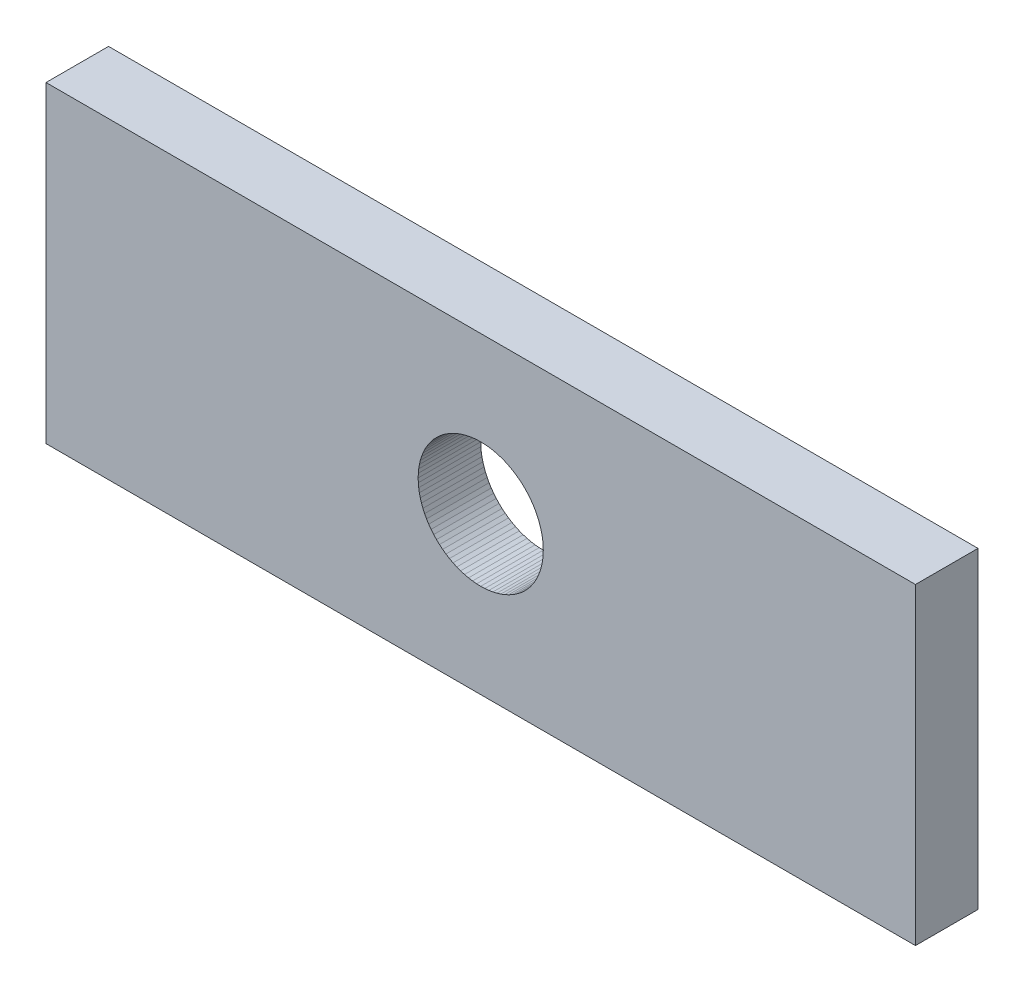
from build123d import *

# Parameters (mm, degrees)
SKETCH1_W           = 69.5
SKETCH1_H           = 25
BOSS_EXTRUDE1_DEPTH = 2.5


with BuildPart() as part:
    # Sketch1 → Boss-Extrude1 (new, symmetric)
    with BuildSketch(Plane.XY):
        with Locations((1368.295659386, -201.441167375)):
            Rectangle(SKETCH1_W, SKETCH1_H)
        Polygon((1370.795659386, -197.111040356), (1370.507102837, -196.956803667), (1370.209076548, -196.821769712), (1369.902856712, -196.706516727), (1369.589754611, -196.611538243), (1369.271110996, -196.537240973), (1368.948290347, -196.483943068), (1368.622675032, -196.451872759), (1368.295659386, -196.441167375), (1367.96864374, -196.451872759), (1367.643028425, -196.483943068), (1367.320207776, -196.537240973), (1367.00156416, -196.611538243), (1366.688462059, -196.706516727), (1366.382242224, -196.821769712), (1366.084215935, -196.956803667), (1365.795659386, -197.111040356), (1365.517808221, -197.283819313), (1365.251852241, -197.474400673), (1364.99893031, -197.681968337), (1364.76012548, -197.905633469), (1364.536460348, -198.144438299), (1364.328892684, -198.39736023), (1364.138311324, -198.66331621), (1363.965532367, -198.941167375), (1363.811295678, -199.229723924), (1363.676261723, -199.527750213), (1363.561008738, -199.833970048), (1363.466030254, -200.147072149), (1363.391732984, -200.465715765), (1363.338435079, -200.788536414), (1363.30636477, -201.114151729), (1363.295659386, -201.441167375), (1363.30636477, -201.768183021), (1363.338435079, -202.093798336), (1363.391732984, -202.416618985), (1363.466030254, -202.7352626), (1363.561008738, -203.048364701), (1363.676261723, -203.354584537), (1363.811295678, -203.652610826), (1363.965532367, -203.941167375), (1364.138311324, -204.21901854), (1364.328892684, -204.48497452), (1364.536460348, -204.73789645), (1364.76012548, -204.976701281), (1364.99893031, -205.200366412), (1365.251852241, -205.407934076), (1365.517808221, -205.598515436), (1365.795659386, -205.771294394), (1366.084215935, -205.925531082), (1366.382242224, -206.060565037), (1366.688462059, -206.175818022), (1367.00156416, -206.270796506), (1367.320207776, -206.345093777), (1367.643028425, -206.398391682), (1367.96864374, -206.430461991), (1368.295659386, -206.441167375), (1368.622675032, -206.430461991), (1368.948290347, -206.398391682), (1369.271110996, -206.345093777), (1369.589754611, -206.270796506), (1369.902856712, -206.175818022), (1370.209076548, -206.060565037), (1370.507102837, -205.925531082), (1370.795659386, -205.771294394), (1371.073510551, -205.598515436), (1371.339466531, -205.407934076), (1371.592388461, -205.200366412), (1371.831193292, -204.976701281), (1372.054858423, -204.73789645), (1372.262426087, -204.48497452), (1372.453007447, -204.21901854), (1372.625786405, -203.941167375), (1372.780023094, -203.652610826), (1372.915057048, -203.354584537), (1373.030310033, -203.048364701), (1373.125288517, -202.7352626), (1373.199585788, -202.416618985), (1373.252883693, -202.093798336), (1373.284954002, -201.768183021), (1373.295659386, -201.441167375), (1373.284954002, -201.114151729), (1373.252883693, -200.788536414), (1373.199585788, -200.465715765), (1373.125288517, -200.147072149), (1373.030310033, -199.833970048), (1372.915057048, -199.527750213), (1372.780023094, -199.229723924), (1372.625786405, -198.941167375), (1372.453007447, -198.66331621), (1372.262426087, -198.39736023), (1372.054858423, -198.144438299), (1371.831193292, -197.905633469), (1371.592388461, -197.681968337), (1371.339466531, -197.474400673), (1371.073510551, -197.283819313), align=None, mode=Mode.SUBTRACT)
    extrude(amount=BOSS_EXTRUDE1_DEPTH, both=True)


solid = part.part
